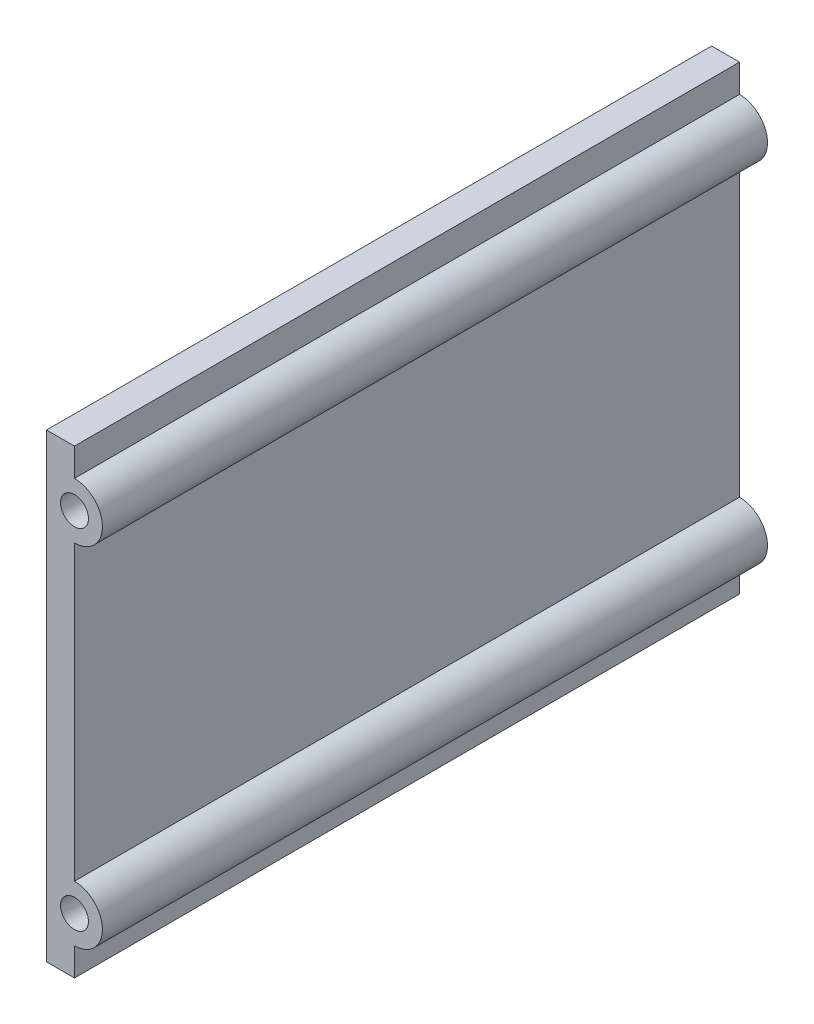
from build123d import *

# Parameters (mm, degrees)
SKETCH_1_R      = 2.5
EXTRUDE_1_DEPTH = 119


with BuildPart() as part:
    # 草图1 → 凸台-拉伸1 (new body)
    with BuildSketch(Plane.XY):
        with BuildLine():
            Line((-166.5, 31.210634294), (-166.5, -31.210634294))
            Line((-166.5, -31.210634294), (-166.5, -36.210634294))
            Line((-166.5, -36.210634294), (-166.5, -41.210634294))
            Line((-166.5, -41.210634294), (-161.5, -41.210634294))
            Line((-161.5, -41.210634294), (-161.5, -36.210634294))
            ThreePointArc((-161.5, -36.210634294), (-156.5, -31.210634294), (-161.5, -26.210634294))
            Line((-161.5, -26.210634294), (-161.5, 26.210634294))
            ThreePointArc((-161.5, 26.210634294), (-156.5, 31.210634294), (-161.5, 36.210634294))
            Line((-161.5, 36.210634294), (-161.5, 41.210634294))
            Line((-161.5, 41.210634294), (-166.5, 41.210634294))
            Line((-166.5, 41.210634294), (-166.5, 36.210634294))
            Line((-166.5, 36.210634294), (-166.5, 31.210634294))
        make_face()
        with Locations(Location((-161.5, 31.210634294, 0), (0, 0, 270))):
            Circle(SKETCH_1_R, mode=Mode.SUBTRACT)
        with Locations(Location((-161.5, -31.210634294, 0), (0, 0, 270))):
            Circle(SKETCH_1_R, mode=Mode.SUBTRACT)
    extrude(amount=EXTRUDE_1_DEPTH)


solid = part.part
